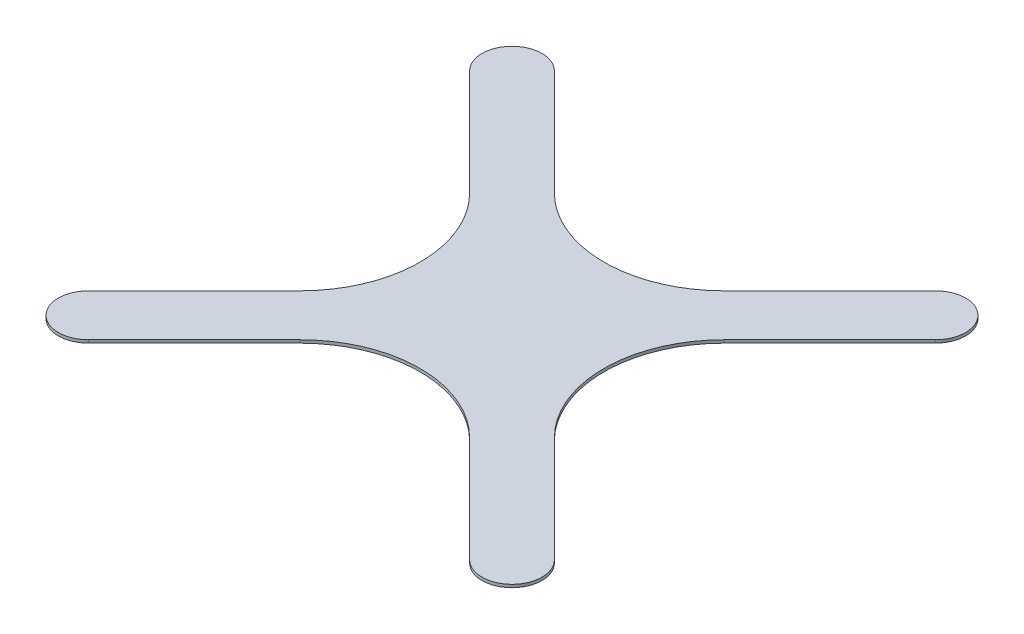
from build123d import *

# Parameters (mm, degrees)
BOSS_EXTRUDE1_DEPTH = 1.5748


with BuildPart() as part:
    # Sketch1 → Boss-Extrude1 (new body)
    with BuildSketch(Plane(origin=(0, 0, 0), x_dir=(1, 0, 0), z_dir=(0, 1, 0))):
        with BuildLine():
            Line((-96.808521665, 144.207881362), (-40.681920908, 88.081280605))
            ThreePointArc((-40.681920908, 88.081280605), (-22.083201513, 43.18), (-40.681920908, -1.721280605))
            Line((-40.681920908, -1.721280605), (-96.808521665, -57.847881362))
            ThreePointArc((-96.808521665, -57.847881362), (-96.808521665, -80.298521665), (-74.357881362, -80.298521665))
            Line((-74.357881362, -80.298521665), (-18.231280605, -24.171920908))
            ThreePointArc((-18.231280605, -24.171920908), (26.67, -5.573201513), (71.571280605, -24.171920908))
            Line((71.571280605, -24.171920908), (127.697881362, -80.298521665))
            ThreePointArc((127.697881362, -80.298521665), (150.148521665, -80.298521665), (150.148521665, -57.847881362))
            Line((150.148521665, -57.847881362), (94.021920908, -1.721280605))
            ThreePointArc((94.021920908, -1.721280605), (75.423201513, 43.18), (94.021920908, 88.081280605))
            Line((94.021920908, 88.081280605), (150.148521665, 144.207881362))
            ThreePointArc((150.148521665, 144.207881362), (150.148521665, 166.658521665), (127.697881362, 166.658521665))
            Line((127.697881362, 166.658521665), (71.571280605, 110.531920908))
            ThreePointArc((71.571280605, 110.531920908), (26.67, 91.933201513), (-18.231280605, 110.531920908))
            Line((-18.231280605, 110.531920908), (-74.357881362, 166.658521665))
            ThreePointArc((-74.357881362, 166.658521665), (-96.808521665, 166.658521665), (-96.808521665, 144.207881362))
        make_face()
    extrude(amount=BOSS_EXTRUDE1_DEPTH)


solid = part.part
